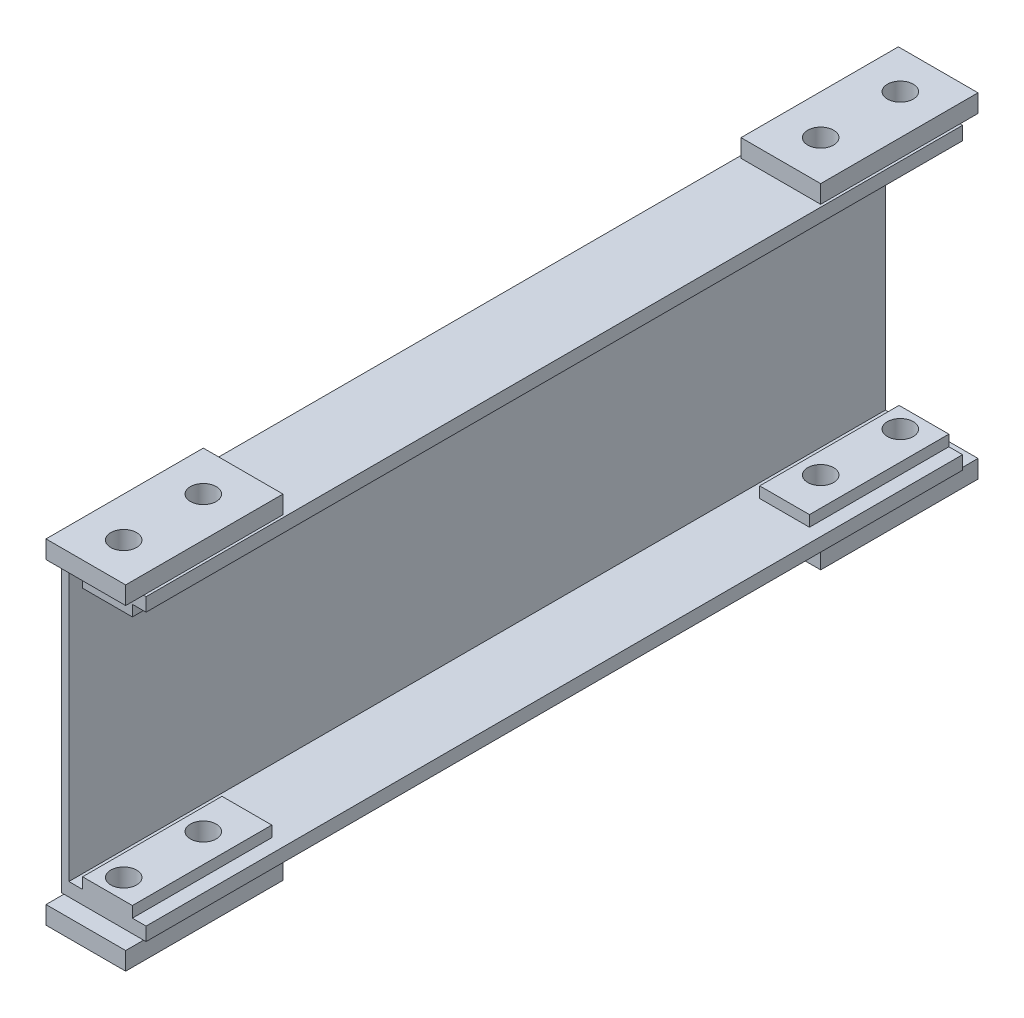
from build123d import *

# Parameters (mm, degrees)
SKETCH_1_W               = 85
SKETCH_1_H               = 300
EXTRUDE_1_DEPTH          = 820
SKETCH_2_W               = 77.5
SKETCH_2_H               = 273
CUT_EXTRUDE_1_DEPTH      = 878.282736636
SKETCH_5_W               = 50
SKETCH_5_H               = 140
EXTRUDE_3_DEPTH          = 11
SKETCH_6_W               = 80
SKETCH_6_H               = 158
EXTRUDE_4_DEPTH          = 18
SKETCH_8_R               = 13
CUT_EXTRUDE_3_DEPTH      = 884.600022635
MIRROR_4_COPY_1_SKETCH_W = 50
MIRROR_4_COPY_1_SKETCH_H = 140
MIRROR_4_COPY_1_DEPTH    = 11
MIRROR_4_COPY_2_SKETCH_W = 80
MIRROR_4_COPY_2_SKETCH_H = 158
MIRROR_4_COPY_2_DEPTH    = 18
MIRROR_4_COPY_3_SKETCH_R = 13
MIRROR_4_COPY_3_DEPTH    = 884.600022635


with BuildPart() as part:
    # 草图1 → 凸台-拉伸1 (new body)
    with BuildSketch(Plane.XY):
        with Locations((42.5, 150)):
            Rectangle(SKETCH_1_W, SKETCH_1_H)
    extrude(amount=EXTRUDE_1_DEPTH)

    # 草图2 → 切除-拉伸1 (cut, through all)
    with BuildSketch(Plane.XY.offset(820)):
        with Locations((46.25, 150)):
            Rectangle(SKETCH_2_W, SKETCH_2_H)
    extrude(amount=-CUT_EXTRUDE_1_DEPTH, mode=Mode.SUBTRACT)

    # 草图5 → 凸台-拉伸3 (add)
    with BuildSketch(Plane.XZ.offset(-286.5)):
        with Locations((46.25, 70)):
            Rectangle(SKETCH_5_W, SKETCH_5_H)
    extrude_3 = extrude(amount=EXTRUDE_3_DEPTH)

    # 草图6 → 凸台-拉伸4 (add)
    with BuildSketch(Plane(origin=(0, 300, 0), x_dir=(1, 0, 0), z_dir=(0, 1, 0))):
        with Locations((42.5, -61)):
            Rectangle(SKETCH_6_W, SKETCH_6_H)
    extrude_4 = extrude(amount=EXTRUDE_4_DEPTH)

    # 草图8 → 切除-拉伸3 (cut, through all)
    with BuildSketch(Plane(origin=(0, 318, 0), x_dir=(1, 0, 0), z_dir=(0, 1, 0))):
        with Locations(Location((42.5, -20, 0), (0, 0, 270))):
            Circle(SKETCH_8_R)
        with Locations(Location((42.5, -100, 0), (0, 0, 270))):
            Circle(SKETCH_8_R)
    cut_extrude_3 = extrude(amount=-CUT_EXTRUDE_3_DEPTH, mode=Mode.SUBTRACT)

    # 镜向3: 凸台-拉伸3, 凸台-拉伸4, 切除-拉伸3 across plane
    add(extrude_3.mirror(Plane(origin=(0, 150, 0), x_dir=(0, 0, 1), z_dir=(0, -1, 0))))
    add(extrude_4.mirror(Plane(origin=(0, 150, 0), x_dir=(0, 0, 1), z_dir=(0, -1, 0))))
    add(cut_extrude_3.mirror(Plane(origin=(0, 150, 0), x_dir=(0, 0, 1), z_dir=(0, -1, 0))), mode=Mode.SUBTRACT)

    # 镜向4: 凸台-拉伸3, 凸台-拉伸4, 切除-拉伸3 across plane
    add(extrude_3.mirror(Plane(origin=(0, 0, 410), x_dir=(1, 0, 0), z_dir=(0, 0, -1))))
    add(extrude_4.mirror(Plane(origin=(0, 0, 410), x_dir=(1, 0, 0), z_dir=(0, 0, -1))))
    add(cut_extrude_3.mirror(Plane(origin=(0, 0, 410), x_dir=(1, 0, 0), z_dir=(0, 0, -1))), mode=Mode.SUBTRACT)

    # 镜向4 copy 1 sketch → 镜向4 copy 1 (add)
    with BuildSketch(Plane(origin=(0, 13.5, 820), x_dir=(1, 0, 0), z_dir=(0, 1, 0))):
        with Locations((46.25, 70)):
            Rectangle(MIRROR_4_COPY_1_SKETCH_W, MIRROR_4_COPY_1_SKETCH_H)
    extrude(amount=MIRROR_4_COPY_1_DEPTH)

    # 镜向4 copy 2 sketch → 镜向4 copy 2 (add)
    with BuildSketch(Plane(origin=(0, 0, 820), x_dir=(1, 0, 0), z_dir=(0, -1, 0))):
        with Locations((42.5, -61)):
            Rectangle(MIRROR_4_COPY_2_SKETCH_W, MIRROR_4_COPY_2_SKETCH_H)
    extrude(amount=MIRROR_4_COPY_2_DEPTH)

    # 镜向4 copy 3 sketch → 镜向4 copy 3 (cut, through all)
    with BuildSketch(Plane(origin=(0, -18, 820), x_dir=(1, 0, 0), z_dir=(0, -1, 0))):
        with Locations(Location((42.5, -20, 0), (0, 0, 270))):
            Circle(MIRROR_4_COPY_3_SKETCH_R)
        with Locations(Location((42.5, -100, 0), (0, 0, 270))):
            Circle(MIRROR_4_COPY_3_SKETCH_R)
    extrude(amount=-MIRROR_4_COPY_3_DEPTH, mode=Mode.SUBTRACT)


solid = part.part
